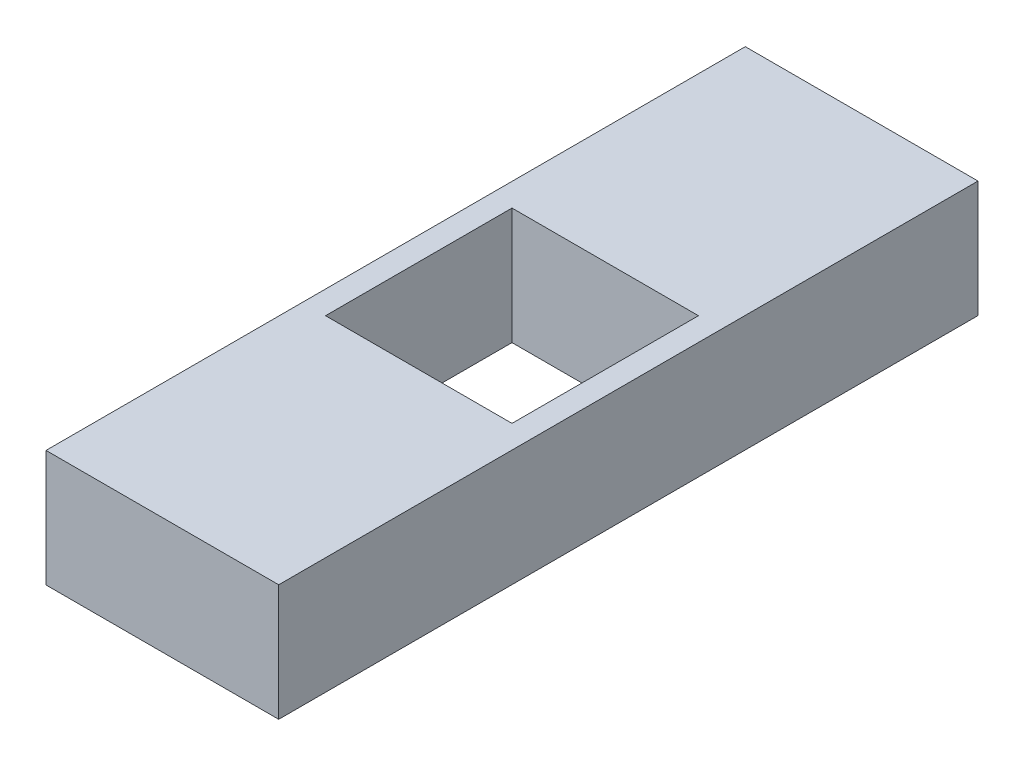
from build123d import *

# Parameters (mm, degrees)
SKETCH1_W           = 76.07554
SKETCH1_H           = 38.1
BOSS_EXTRUDE1_DEPTH = 228.6
SKETCH2_W           = 60.96
SKETCH2_H           = 60.96
CUT_EXTRUDE1_DEPTH  = 235.854086502


with BuildPart() as part:
    # Sketch1 → Boss-Extrude1 (new body)
    with BuildSketch(Plane.XY):
        Rectangle(SKETCH1_W, SKETCH1_H)
    extrude(amount=BOSS_EXTRUDE1_DEPTH)

    # Sketch2 → Cut-Extrude1 (cut, through all)
    with BuildSketch(Plane.XZ.offset(19.05)):
        with Locations((0, 114.3)):
            Rectangle(SKETCH2_W, SKETCH2_H)
    extrude(amount=-CUT_EXTRUDE1_DEPTH, mode=Mode.SUBTRACT)


solid = part.part
